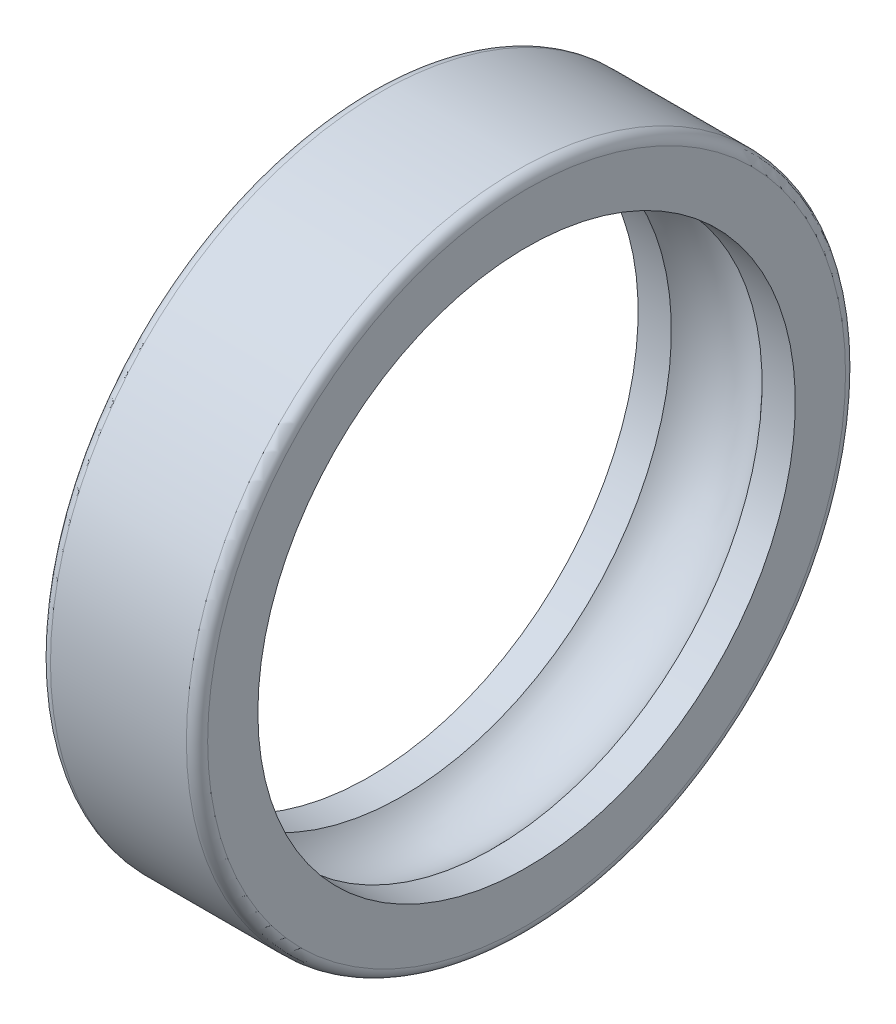
from build123d import *

# Parameters (mm, degrees)
FILLET1_R = 2.1


with BuildPart() as part:
    # Sketch1 → Revolve1 (revolve)
    with BuildSketch(Plane.XY, mode=Mode.PRIVATE) as revolve1_sk:
        with BuildLine():
            Line((-15.5, 65), (15.5, 65))
            Line((15.5, 65), (15.5, 53))
            Line((15.5, 53), (8.94427191, 53))
            ThreePointArc((8.94427191, 53), (0, 57), (-8.94427191, 53))
            Line((-8.94427191, 53), (-15.5, 53))
            Line((-15.5, 53), (-15.5, 65))
        make_face()
    revolve(revolve1_sk.sketch.rotate(Axis((0, 0, 0), (1, 0, 0)), 90), axis=Axis((0, 0, 0), (1, 0, 0)))

    # Fillet1
    fillet1_edges = [part.edges().sort_by_distance(p)[0] for p in [
        (-15.5, 0, -65),
        (15.5, 0, -65),
    ]]
    fillet(fillet1_edges, radius=FILLET1_R)


solid = part.part
